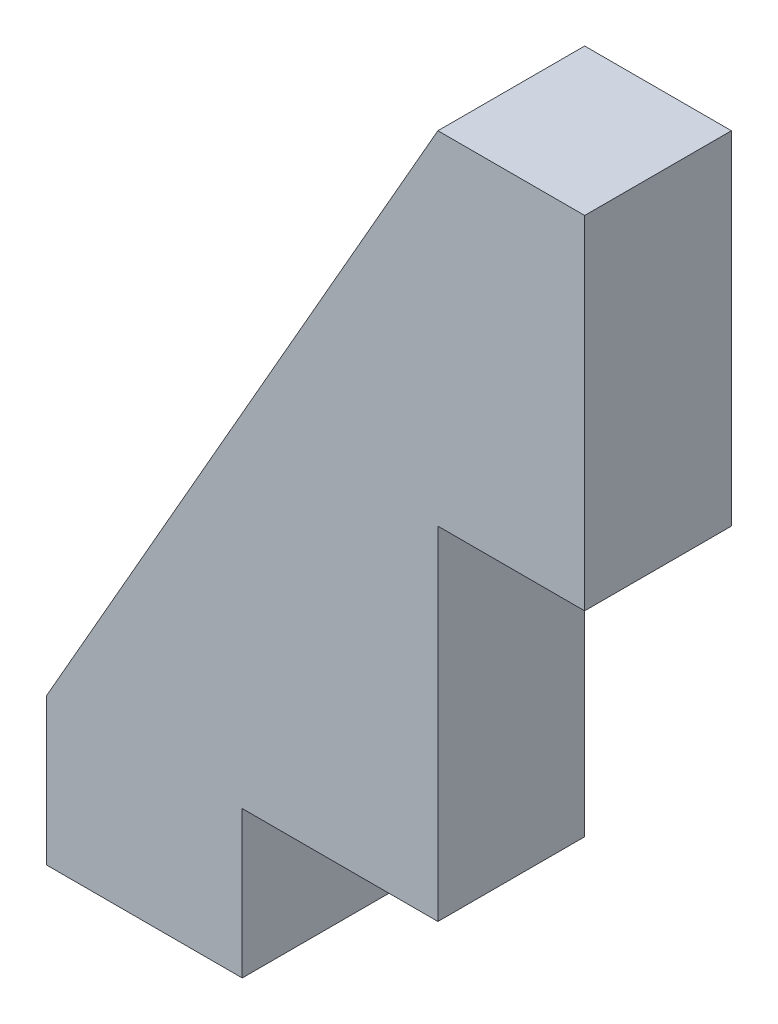
from build123d import *

# Parameters (mm, degrees)
EXTRUDE_1_DEPTH = 3
SKETCH_2_W      = 4
SKETCH_2_H      = 3
EXTRUDE_2_DEPTH = 3
SKETCH_3_W      = 3
SKETCH_3_H      = 7
EXTRUDE_3_DEPTH = 3


with BuildPart() as part:
    # 草图1 → 凸台-拉伸1 (new body)
    with BuildSketch(Plane.XY):
        Polygon((0, 0), (8, 0), (8, 14), align=None)
    extrude(amount=EXTRUDE_1_DEPTH)

    # 草图2 → 凸台-拉伸2 (add)
    with BuildSketch(Plane.XZ):
        with Locations((2, 1.5)):
            Rectangle(SKETCH_2_W, SKETCH_2_H)
    extrude(amount=EXTRUDE_2_DEPTH)

    # 草图3 → 凸台-拉伸3 (add)
    with BuildSketch(Plane(origin=(8, 0, 0), x_dir=(0, 0, -1), z_dir=(1, 0, 0))):
        with Locations((-1.5, 10.5)):
            Rectangle(SKETCH_3_W, SKETCH_3_H)
    extrude(amount=EXTRUDE_3_DEPTH)


solid = part.part
